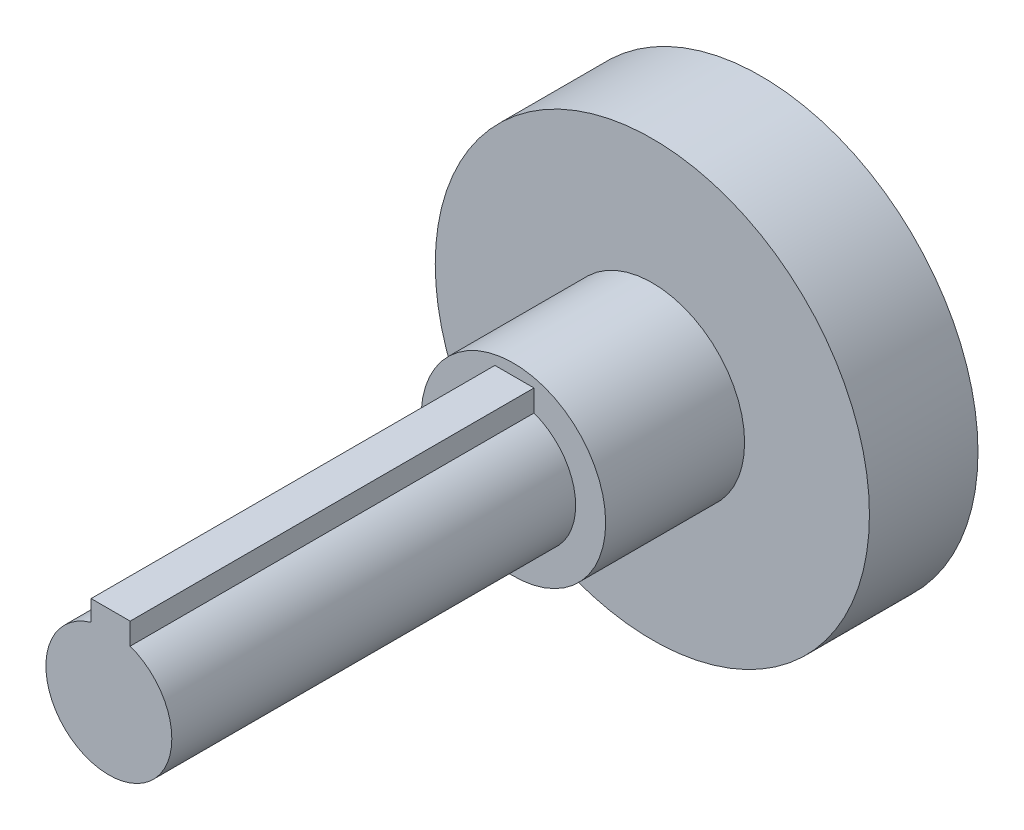
from build123d import *

# Parameters (mm, degrees)
SKETCH1_R           = 10
BOSS_EXTRUDE1_DEPTH = 5
SKETCH3_R           = 4.25
BOSS_EXTRUDE3_DEPTH = 6.4
BOSS_EXTRUDE2_DEPTH = 18.6


with BuildPart() as part:
    # Sketch1 → Boss-Extrude1 (new body)
    with BuildSketch(Plane(origin=(0, 0, 0), x_dir=(0, 1, 0), z_dir=(0, 0, 1))):
        with Locations(Location((0, 0, 0), (0, 0, 270))):
            Circle(SKETCH1_R)
    extrude(amount=BOSS_EXTRUDE1_DEPTH)

    # Sketch3 → Boss-Extrude3 (add)
    with BuildSketch(Plane.XY.offset(5)):
        Circle(SKETCH3_R)
    extrude(amount=BOSS_EXTRUDE3_DEPTH)

    # Sketch2 → Boss-Extrude2 (add)
    with BuildSketch(Plane.XY.offset(11.4)):
        with BuildLine():
            Line((-0.851088332, 3.728872107), (0.948911668, 3.728872107))
            Line((0.948911668, 3.728872107), (0.948911668, 2.728872107))
            ThreePointArc((0.948911668, 2.728872107), (-0.118236387, -2.898733684), (-0.851088332, 2.782083153))
            Line((-0.851088332, 2.782083153), (-0.851088332, 3.728872107))
        make_face()
    extrude(amount=BOSS_EXTRUDE2_DEPTH)


solid = part.part
